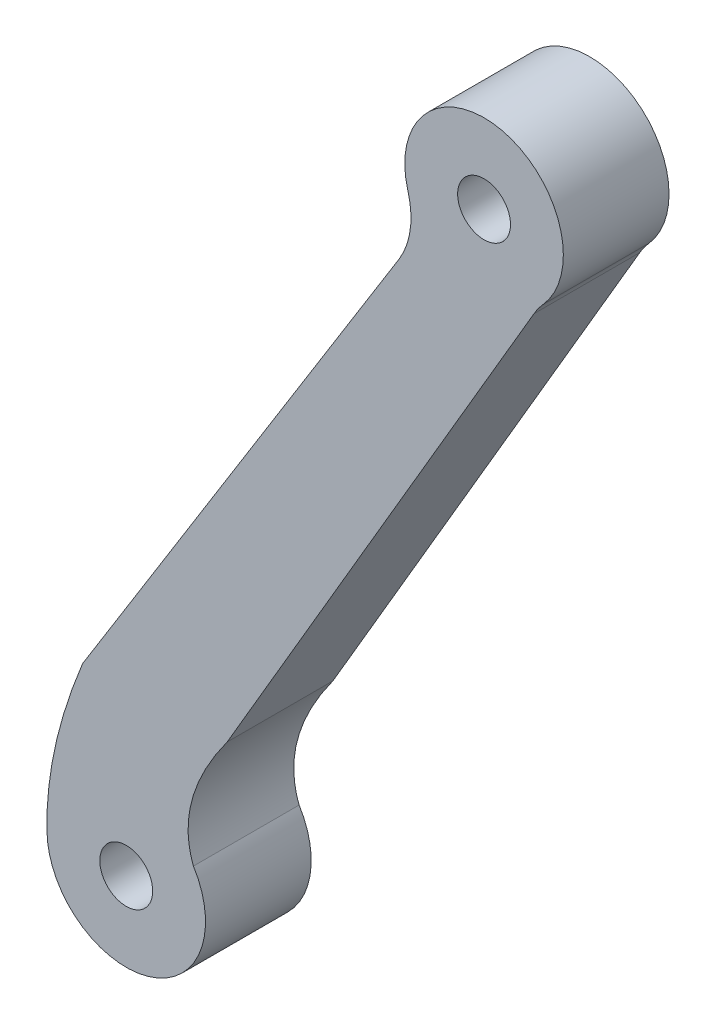
from build123d import *

# Parameters (mm, degrees)
SKETCH6_R           = 1
BOSS_EXTRUDE1_DEPTH = 4


with BuildPart() as part:
    # Sketch6 → Boss-Extrude1 (new body)
    with BuildSketch(Plane.XY):
        with BuildLine():
            Line((24.518959729, 113.266913748), (12.546015233, 94.029173129))
            add(Edge.make_bspline(
                [(12.546015233, 94.029173129), (11.143200975, 90.620780812), (11.195857544, 87.895488842)],
                knots=[0, 0, 0, 1, 1, 1], degree=2))
            ThreePointArc((11.195857544, 87.895488842), (15.023721592, 85.0119769), (16.738951622, 89.486926087))
            add(Edge.make_bspline(
                [(18.016460853, 94.194825281), (15.988617018, 91.415760023), (16.738951622, 89.486926087)],
                knots=[0, 0, 0, 1, 1, 1], degree=2))
            Line((18.016460853, 94.194825281), (29.628743828, 114.037411274))
            ThreePointArc((29.628743828, 114.037411274), (29.791338928, 114.286113373), (29.977739072, 114.517511055))
            ThreePointArc((29.977739072, 114.517511055), (28.402741778, 119.438186194), (24.854741229, 115.682476887))
            ThreePointArc((24.854741229, 115.682476887), (24.943384664, 114.439035131), (24.518959729, 113.266913748))
        make_face()
        with Locations((27.737526551, 116.51286763)):
            Circle(SKETCH6_R, mode=Mode.SUBTRACT)
        with Locations((14.195857544, 87.895488842)):
            Circle(SKETCH6_R, mode=Mode.SUBTRACT)
    extrude(amount=BOSS_EXTRUDE1_DEPTH)


solid = part.part
